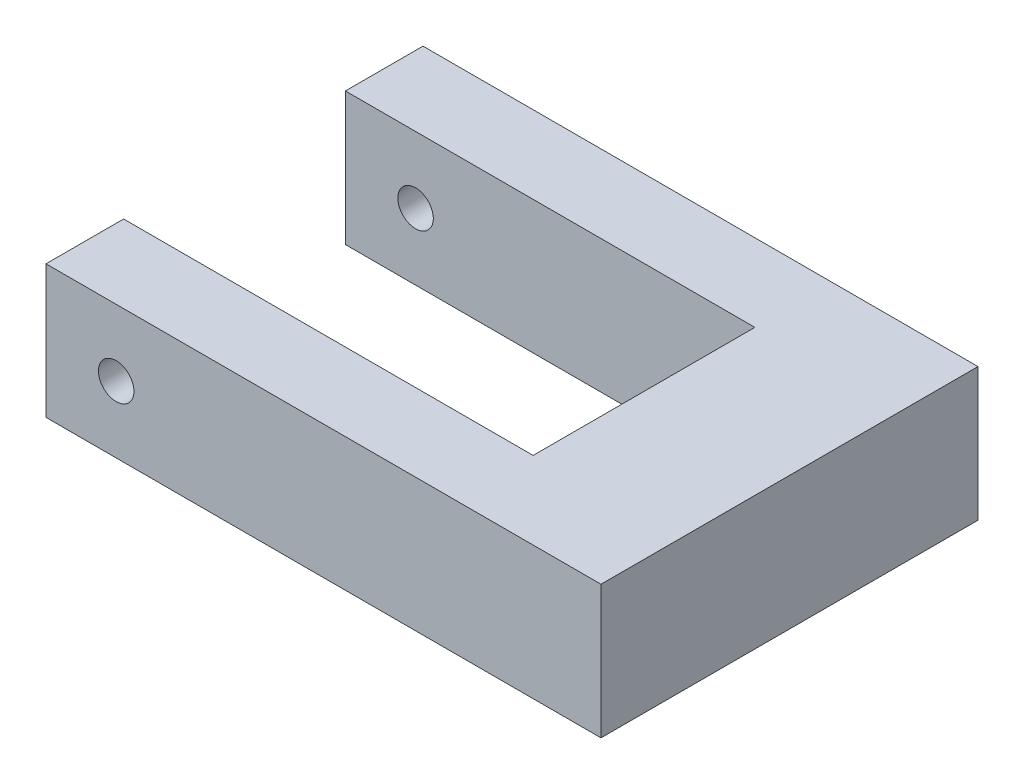
from build123d import *

# Parameters (mm, degrees)
EXTRUDE_START       = 7.5
SKETCH_1_W          = 125.131658012
SKETCH_1_H          = 30
EXTRUDE_1_DEPTH     = 85
SKETCH_3_W          = 94.594294475
SKETCH_3_H          = 50
CUT_EXTRUDE_1_DEPTH = 43.5
SKETCH_4_R          = 4
CUT_EXTRUDE_2_DEPTH = 100


with BuildPart() as part:
    # Эскиз1 → Вытянуть1 (new body)
    with BuildSketch(Plane.XY.offset(EXTRUDE_START)):
        with Locations((62.565829006, -9.041900761)):
            Rectangle(SKETCH_1_W, SKETCH_1_H)
    extrude(amount=-EXTRUDE_1_DEPTH)

    # Эскиз3 → Вырез-Вытянуть1 (cut, symmetric)
    with BuildSketch(Plane(origin=(0, 0, 0), x_dir=(1, 0, 0), z_dir=(0, 1, 0))):
        with Locations((45.031047777, 35)):
            Rectangle(SKETCH_3_W, SKETCH_3_H)
    extrude(amount=CUT_EXTRUDE_1_DEPTH, both=True, mode=Mode.SUBTRACT)

    # Эскиз4 → Вырез-Вытянуть2 (cut, symmetric)
    with BuildSketch(Plane.XY):
        with Locations((15.823953055, -9.041900761)):
            Circle(SKETCH_4_R)
    extrude(amount=CUT_EXTRUDE_2_DEPTH, both=True, mode=Mode.SUBTRACT)


solid = part.part
